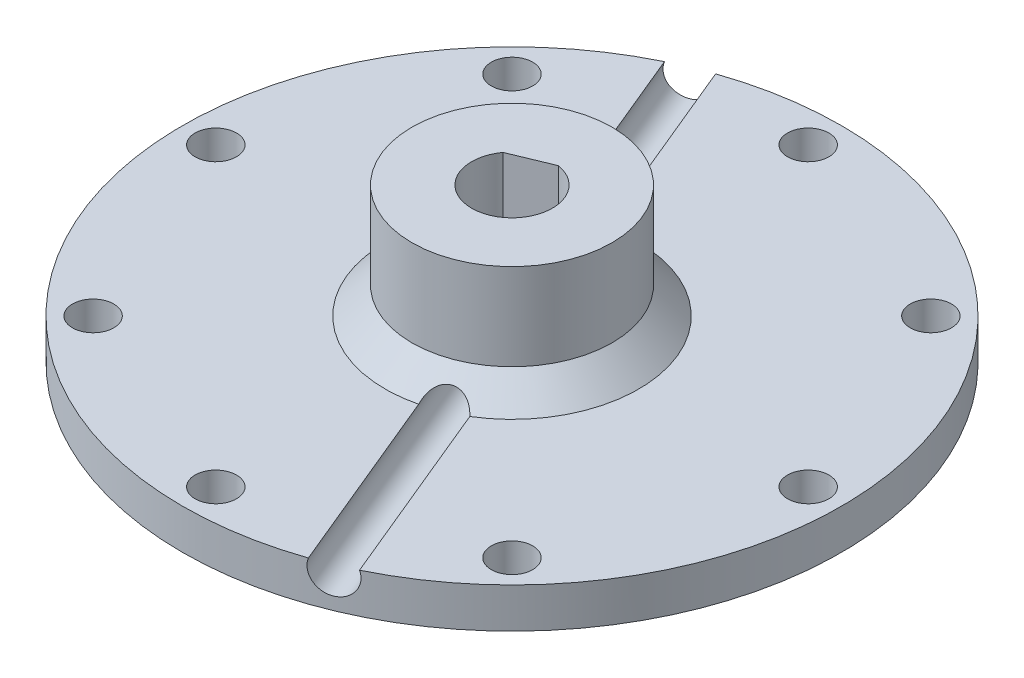
from build123d import *

# Parameters (mm, degrees)
SKETCH_1_R               = 24.696170665
SKETCH_1_R_2             = 1.55
SKETCH_1_R_3             = 7.5
EXTRUDE_1_DEPTH          = 3
SKETCH_1_4_R             = 7.5
EXTRUDE_2_DEPTH          = 11.5
CHAMFER_2_SIZE           = 2
CUT_EXTRUDE_2_DEPTH      = 40.04942882
CUT_EXTRUDE_2_DEPTH_BACK = 40.04942882
SKETCH_5_R               = 1.55


with BuildPart() as part:
    # 草图1 → 凸台-拉伸1 (new body)
    with BuildSketch(Plane(origin=(0, 0, 0), x_dir=(1, 0, 0), z_dir=(0, 1, 0))):
        Circle(SKETCH_1_R)
        with Locations((-15.695062794, -15.695062794)):
            Circle(SKETCH_1_R_2, mode=Mode.SUBTRACT)
        with Locations((0, -22.196170665)):
            Circle(SKETCH_1_R_2, mode=Mode.SUBTRACT)
        with Locations((15.695062794, -15.695062794)):
            Circle(SKETCH_1_R_2, mode=Mode.SUBTRACT)
        with Locations((-22.196170665, 0)):
            Circle(SKETCH_1_R_2, mode=Mode.SUBTRACT)
        with Locations((-15.695062794, 15.695062794)):
            Circle(SKETCH_1_R_2, mode=Mode.SUBTRACT)
        Circle(SKETCH_1_R_3, mode=Mode.SUBTRACT)
        with Locations((22.196170665, 0)):
            Circle(SKETCH_1_R_2, mode=Mode.SUBTRACT)
        with Locations((0, 22.196170665)):
            Circle(SKETCH_1_R_2, mode=Mode.SUBTRACT)
        with Locations((15.695062794, 15.695062794)):
            Circle(SKETCH_1_R_2, mode=Mode.SUBTRACT)
    extrude(amount=EXTRUDE_1_DEPTH)

    # 草图1<4> → 凸台-拉伸2 (add)
    with BuildSketch(Plane(origin=(0, 0, 0), x_dir=(1, 0, 0), z_dir=(0, 1, 0))):
        Circle(SKETCH_1_4_R)
        with BuildLine():
            Line((-2.452023129, 1.77149868), (0.481203452, 2.986480912))
            ThreePointArc((0.481203452, 2.986480912), (1.157617383, -2.794735586), (-2.452023129, 1.77149868))
        make_face(mode=Mode.SUBTRACT)
    extrude(amount=EXTRUDE_2_DEPTH)

    # 倒角2
    chamfer_2_edges = [part.edges().sort_by_distance(p)[0] for p in [
        (-7.5, 3, 0),
    ]]
    chamfer(chamfer_2_edges, length=CHAMFER_2_SIZE)

    # 草图5 → 切除-拉伸2 (cut, two sides: drawn at the far end of the back side and taken through both)
    with BuildSketch(Plane(origin=(-0.985409838, 0, -2.378989796), x_dir=(0.9238795325112868, 0, -0.38268343236508967), z_dir=(0.3826834323650896, 0, 0.9238795325112867)).offset(-CUT_EXTRUDE_2_DEPTH_BACK)):
        with Locations((0, 2.5)):
            Circle(SKETCH_5_R)
    extrude(amount=CUT_EXTRUDE_2_DEPTH + CUT_EXTRUDE_2_DEPTH_BACK, mode=Mode.SUBTRACT)


solid = part.part
